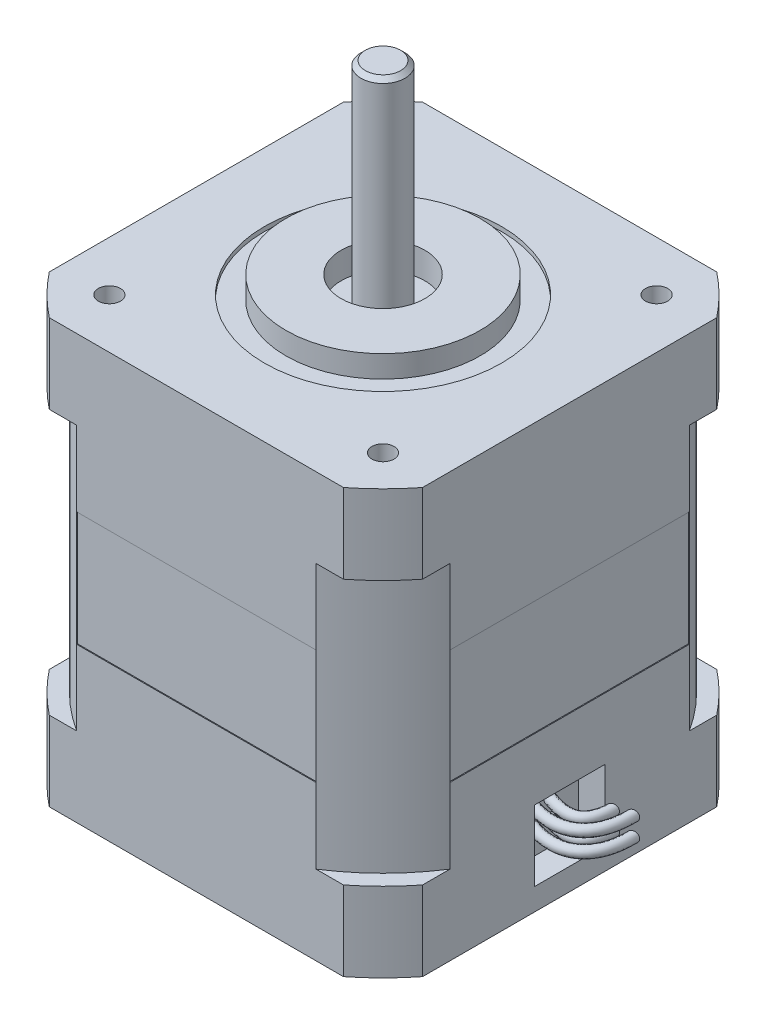
from build123d import *

# Parameters (mm, degrees)
BOSS_EXTRUDE2_DEPTH       = 48
SKETCH3_W                 = 5
SKETCH3_H                 = 30
SKETCH4_R                 = 13.425
CUT_EXTRUDE1_DEPTH        = 0.5
SKETCH5_R                 = 11
BOSS_EXTRUDE3_DEPTH       = 2.5
SKETCH6_R                 = 4.75
CUT_EXTRUDE2_DEPTH        = 3
SKETCH7_R                 = 2.5
BOSS_EXTRUDE4_DEPTH       = 24
CHAMFER1_SIZE             = 0.5
SKETCH8_R                 = 4.5
CUT_EXTRUDE3_DEPTH        = 3
M3X0_5_TAPPED_HOLE1_D     = 2.5
M3X0_5_TAPPED_HOLE1_DEPTH = 4.5
M3X0_5_TAPPED_HOLE1_TIP   = 0.751075774
SKETCH12_W                = 8
SKETCH12_H                = 8
CUT_EXTRUDE4_DEPTH        = 3
SKETCH13_R                = 0.6
SKETCH15_W                = 27.125126728
SKETCH15_H                = 13
CUT_EXTRUDE5_DEPTH        = 0.1
CIRPATTERN1_COUNT         = 4


with BuildPart() as part:
    # Sketch1 → Boss-Extrude2 (new body)
    with BuildSketch(Plane(origin=(0, 0, 0), x_dir=(1, 0, 0), z_dir=(0, 1, 0))):
        with BuildLine():
            Line((-21.15, 16.662326518), (-21.15, -16.662326518))
            ThreePointArc((-21.15, -16.662326518), (-19.038850083, -19.038850083), (-16.662326518, -21.15))
            Line((-16.662326518, -21.15), (16.662326518, -21.15))
            ThreePointArc((16.662326518, -21.15), (19.038850083, -19.038850083), (21.15, -16.662326518))
            Line((21.15, -16.662326518), (21.15, 16.662326518))
            ThreePointArc((21.15, 16.662326518), (19.038850083, 19.038850083), (16.662326518, 21.15))
            Line((16.662326518, 21.15), (-16.662326518, 21.15))
            ThreePointArc((-16.662326518, 21.15), (-19.038850083, 19.038850083), (-21.15, 16.662326518))
        make_face()
    extrude(amount=BOSS_EXTRUDE2_DEPTH)

    # Sketch3 → Cut-Revolve1 (revolve, cut)
    with BuildSketch(Plane.XY):
        with Locations((-27.625, 24)):
            Rectangle(SKETCH3_W, SKETCH3_H)
    revolve(axis=Axis((0, -2.013056064, 0), (0, 1, 0)), mode=Mode.SUBTRACT)

    # Sketch4 → Cut-Extrude1 (cut)
    with BuildSketch(Plane(origin=(0, 48, 0), x_dir=(1, 0, 0), z_dir=(0, 1, 0))):
        Circle(SKETCH4_R)
    extrude(amount=-CUT_EXTRUDE1_DEPTH, mode=Mode.SUBTRACT)

    # Sketch5 → Boss-Extrude3 (add)
    with BuildSketch(Plane(origin=(0, 47.5, 0), x_dir=(1, 0, 0), z_dir=(0, 1, 0))):
        Circle(SKETCH5_R)
    extrude(amount=BOSS_EXTRUDE3_DEPTH)

    # Sketch6 → Cut-Extrude2 (cut)
    with BuildSketch(Plane(origin=(0, 50, 0), x_dir=(1, 0, 0), z_dir=(0, 1, 0))):
        Circle(SKETCH6_R)
    extrude(amount=-CUT_EXTRUDE2_DEPTH, mode=Mode.SUBTRACT)

    # Sketch7 → Boss-Extrude4 (add)
    with BuildSketch(Plane(origin=(0, 47, 0), x_dir=(1, 0, 0), z_dir=(0, 1, 0))):
        Circle(SKETCH7_R)
    extrude(amount=BOSS_EXTRUDE4_DEPTH)

    # Chamfer1
    chamfer1_edges = [part.edges().sort_by_distance(p)[0] for p in [
        (-2.5, 71, 0),
    ]]
    chamfer(chamfer1_edges, length=CHAMFER1_SIZE)

    # Sketch8 → Cut-Extrude3 (cut)
    with BuildSketch(Plane.XZ):
        Circle(SKETCH8_R)
    extrude(amount=-CUT_EXTRUDE3_DEPTH, mode=Mode.SUBTRACT)

    # M3x0.5 Tapped Hole1
    with Locations(Plane(origin=(0, 48, 0), x_dir=(1, 0, 0), z_dir=(0, 1, 0))):
        with Locations((-15.5, -15.5), (-15.5, 15.5), (15.5, 15.5), (15.5, -15.5)):
            Hole(M3X0_5_TAPPED_HOLE1_D / 2, depth=M3X0_5_TAPPED_HOLE1_DEPTH)
            with Locations((0, 0, -(M3X0_5_TAPPED_HOLE1_DEPTH + M3X0_5_TAPPED_HOLE1_TIP / 2))):  # 118° drill point
                Cone(0, M3X0_5_TAPPED_HOLE1_D / 2, M3X0_5_TAPPED_HOLE1_TIP, mode=Mode.SUBTRACT)

    # Sketch12 → Cut-Extrude4 (cut)
    with BuildSketch(Plane(origin=(21.15, 0, 0), x_dir=(0, 0, -1), z_dir=(1, 0, 0))):
        with Locations((0, 6.5)):
            Rectangle(SKETCH12_W, SKETCH12_H)
    extrude(amount=-CUT_EXTRUDE4_DEPTH, mode=Mode.SUBTRACT)

    # Sweep2: sweep along a path in Sketch14
    with BuildLine() as sweep2_path:  # in the path sketch's own coordinates; laid on its plane below (add() does not lay a ready-made edge on the line's plane)
        add(Edge.make_bspline(
            [(17.676713236, 0), (23.6460823, -2.366766531), (23.798444163, 3.357568307)],
            knots=[0, 0, 0, 1, 1, 1], degree=2))
    # Sketch13 → Sweep2 (sweep)
    with BuildSketch(Plane(origin=(18.15, 0, 0), x_dir=(0, 0, -1), z_dir=(1, 0, 0))):
        with Locations((-1.112460133, 7.415030797)):
            Circle(SKETCH13_R)
        with Locations((0.707044587, 7.415030797)):
            Circle(SKETCH13_R)
        with Locations((-1.112460133, 5.332176709)):
            Circle(SKETCH13_R)
        with Locations((0.707044587, 5.332176709)):
            Circle(SKETCH13_R)
    sweep(path=Plane(origin=(0, 0, 0), x_dir=(1, 0, 0), z_dir=(0, 1, 0)) * sweep2_path.line)

    # Sketch15 → Cut-Extrude5 (cut)
    with BuildSketch(Plane(origin=(0, 0, -21.15), x_dir=(-1, 0, 0), z_dir=(0, 0, -1))):
        with Locations((0, 24)):
            Rectangle(SKETCH15_W, SKETCH15_H)
    cut_extrude5 = extrude(amount=-CUT_EXTRUDE5_DEPTH, mode=Mode.SUBTRACT)

    # CirPattern1: Cut-Extrude5 ×4 about axis
    cirpattern1_axis = Axis((0, 0, 0), (0, 1, 0))
    for i in range(1, CIRPATTERN1_COUNT):
        add(cut_extrude5.rotate(cirpattern1_axis, i * 360 / CIRPATTERN1_COUNT), mode=Mode.SUBTRACT)


solid = part.part
